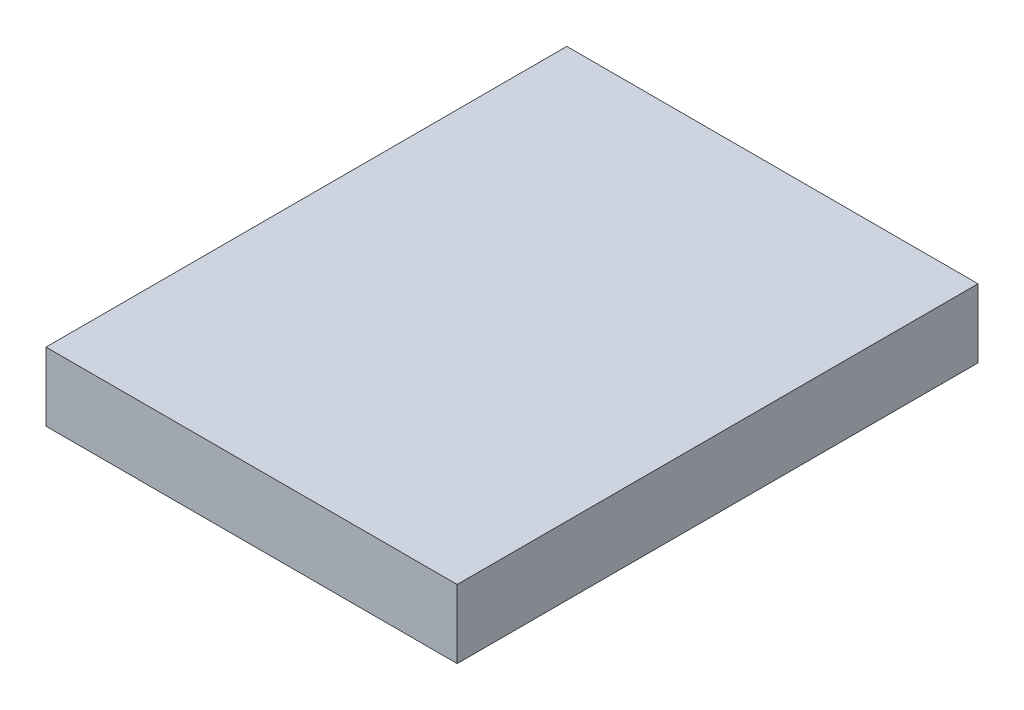
from build123d import *

# Parameters (mm, degrees)
SKETCH1_W           = 120
SKETCH1_H           = 152
BOSS_EXTRUDE1_DEPTH = 20


with BuildPart() as part:
    # Sketch1 → Boss-Extrude1 (new body)
    with BuildSketch(Plane(origin=(0, 0, 0), x_dir=(1, 0, 0), z_dir=(0, 1, 0))):
        Rectangle(SKETCH1_W, SKETCH1_H)
    extrude(amount=BOSS_EXTRUDE1_DEPTH)


solid = part.part
